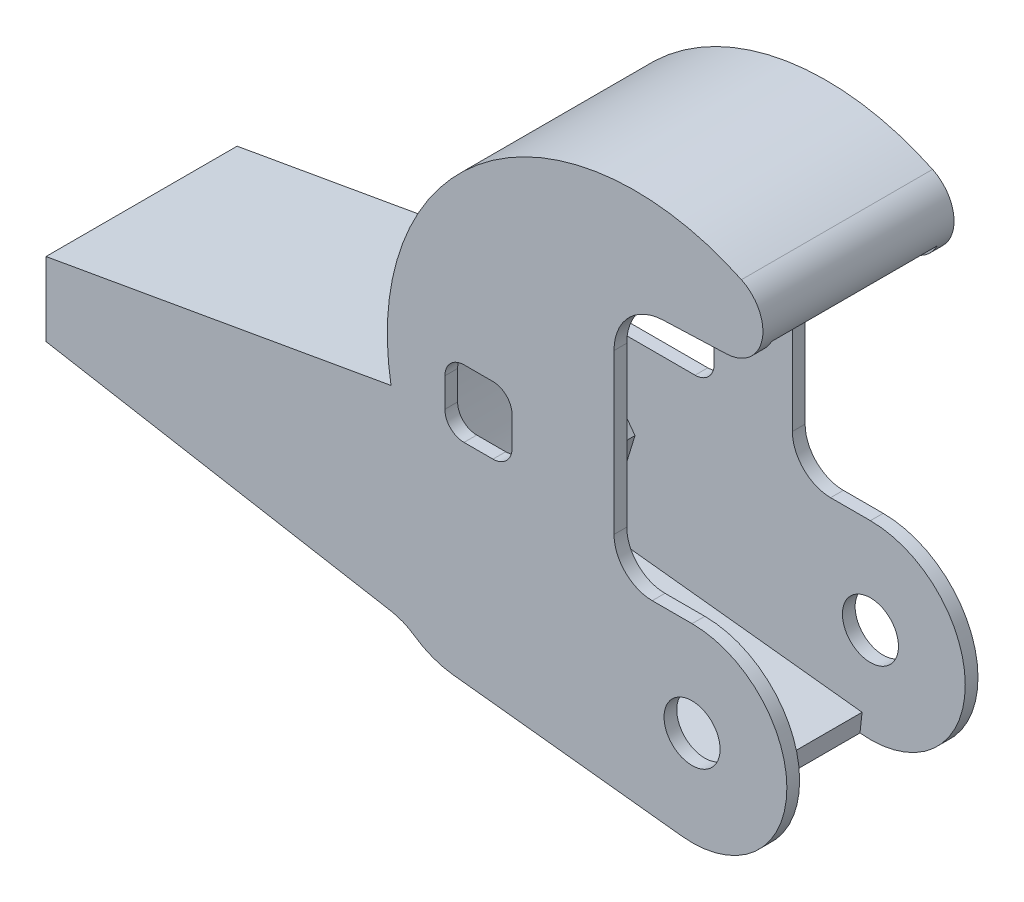
from build123d import *

# Parameters (mm, degrees)
BOSS_EXTRUDE1_DEPTH = 30
SKETCH2_R           = 4.4
CUT_EXTRUDE1_DEPTH  = 101.775803332
SKETCH4_W           = 26
SKETCH4_H           = 53.255509589
CUT_EXTRUDE2_DEPTH  = 40
CUT_EXTRUDE3_DEPTH  = 13
CUT_EXTRUDE4_DEPTH  = 22
CUT_EXTRUDE5_DEPTH  = 29
CUT_EXTRUDE6_DEPTH  = 13
CUT_EXTRUDE7_DEPTH  = 13
CUT_EXTRUDE8_DEPTH  = 13
CUT_EXTRUDE9_DEPTH  = 13


with BuildPart() as part:
    # Sketch1 → Boss-Extrude1 (new body)
    with BuildSketch(Plane.XY):
        with BuildLine():
            Line((-41.88810428, 5.785), (12.276322136, 15.335649772))
            ThreePointArc((12.276322136, 15.335649772), (27.01721186, 53.031344507), (67.276322136, 57.210252411))
            ThreePointArc((67.276322136, 57.210252411), (70.530137672, 50.676906919), (64.962620823, 45.957301533))
            Line((64.962620823, 45.957301533), (54.969956327, 45.574344273))
            ThreePointArc((54.969956327, 45.574344273), (49.512168838, 43.127692894), (47.276322136, 37.580212676))
            Line((47.276322136, 37.580212676), (47.276322136, 12.580212676))
            ThreePointArc((47.276322136, 12.580212676), (49.033681448, 8.337571989), (53.276322136, 6.580212676))
            Line((53.276322136, 6.580212676), (59.526322136, 6.580212676))
            ThreePointArc((59.526322136, 6.580212676), (74.390705288, -9.127420407), (57.887586742, -23.103353356))
            Line((57.887586742, -23.103353356), (22.023718903, -19.131387173))
            ThreePointArc((22.023718903, -19.131387173), (18.826238067, -18.366578697), (15.915778413, -16.837513523))
            ThreePointArc((15.915778413, -16.837513523), (14.177787103, -15.888509343), (12.276322136, -15.335649772))
            Line((12.276322136, -15.335649772), (-41.88810428, -5.785))
            Line((-41.88810428, -5.785), (-41.88810428, 5.785))
        make_face()
    extrude(amount=BOSS_EXTRUDE1_DEPTH)

    # Sketch2 → Cut-Extrude1 (cut, through all)
    with BuildSketch(Plane.XY.offset(30)):
        with Locations((59.526322136, -8.306805028)):
            Circle(SKETCH2_R)
    extrude(amount=-CUT_EXTRUDE1_DEPTH, mode=Mode.SUBTRACT)

    # Sketch4 → Cut-Extrude2 (cut)
    with BuildSketch(Plane(origin=(70, 0, 0), x_dir=(0, 0, -1), z_dir=(1, 0, 0))):
        with Locations((-15, 24.841006249)):
            Rectangle(SKETCH4_W, SKETCH4_H)
    extrude(amount=-CUT_EXTRUDE2_DEPTH, mode=Mode.SUBTRACT)

    # Sketch5 → Cut-Extrude3 (cut, symmetric)
    with BuildSketch(Plane.XY.offset(15)):
        with BuildLine():
            ThreePointArc((30, 51.468761043), (14.752383127, 23.887752406), (27.160195833, -5.082025668))
            add(Edge.make_bspline(
                [(27.160195833, -5.082025668), (28.094948904, -5.887577241), (30.586732107, -8.19455625), (37.238701336, -9.917559519), (48.959505276, -8.540216128), (58.394612416, -6.238640535), (63.488820328, -1.786748546)],
                knots=[0, 0, 0, 0, 0.09340361, 0.26111983, 0.503691176, 1, 1, 1, 1], degree=3))
            Line((63.488820328, -1.786748546), (35, -1.786748546))
            ThreePointArc((35, -1.786748546), (31.464466094, -0.322282452), (30, 3.213251454))
            Line((30, 3.213251454), (30, 51.468761043))
        make_face()
    extrude(amount=CUT_EXTRUDE3_DEPTH, both=True, mode=Mode.SUBTRACT)

    # Sketch6 → Cut-Extrude4 (cut)
    with BuildSketch(Plane.XY.offset(15)):
        with BuildLine():
            Line((32, 24.594919279), (20, 24.594919279))
            ThreePointArc((20, 24.594919279), (17.878679656, 23.716239623), (17, 21.594919279))
            Line((17, 21.594919279), (17, 15.594919279))
            ThreePointArc((17, 15.594919279), (17.878679656, 13.473598935), (20, 12.594919279))
            Line((20, 12.594919279), (32, 12.594919279))
            ThreePointArc((32, 12.594919279), (34.121320344, 13.473598935), (35, 15.594919279))
            Line((35, 15.594919279), (35, 21.594919279))
            ThreePointArc((35, 21.594919279), (34.121320344, 23.716239623), (32, 24.594919279))
        make_face()
    extrude(amount=-CUT_EXTRUDE4_DEPTH, mode=Mode.SUBTRACT)

    # Sketch7 → Cut-Extrude5 (cut)
    with BuildSketch(Plane.XY.offset(15)):
        with BuildLine():
            Line((28.275, 23.869919279), (23.725, 23.869919279))
            ThreePointArc((23.725, 23.869919279), (21.603679656, 22.991239623), (20.725, 20.869919279))
            Line((20.725, 20.869919279), (20.725, 16.319919279))
            ThreePointArc((20.725, 16.319919279), (21.603679656, 14.198598935), (23.725, 13.319919279))
            Line((23.725, 13.319919279), (28.275, 13.319919279))
            ThreePointArc((28.275, 13.319919279), (30.396320344, 14.198598935), (31.275, 16.319919279))
            Line((31.275, 16.319919279), (31.275, 20.869919279))
            ThreePointArc((31.275, 20.869919279), (30.396320344, 22.991239623), (28.275, 23.869919279))
        make_face()
    extrude(amount=CUT_EXTRUDE5_DEPTH, mode=Mode.SUBTRACT)

    # Sketch9 → Cut-Extrude6 (cut, symmetric)
    with BuildSketch(Plane.XY.offset(15)):
        with BuildLine():
            add(Edge.make_bspline(
                [(27.160195833, -5.082025668), (28.094948904, -5.887577241), (30.586732107, -8.19455625), (37.238701336, -9.917559519), (45.927597, -8.896503874), (52.39349387, -7.580878177), (55.560202392, -6.40157691)],
                knots=[0, 0, 0, 0, 0.09340361, 0.26111983, 0.503691176, 0.765483911, 0.765483911, 0.765483911, 0.765483911], degree=3))
            ThreePointArc((55.560202392, -6.40157691), (61.448410701, -12.264781222), (60.481418473, -4.011715857))
            add(Edge.make_bspline(
                [(60.481418473, -4.011715857), (61.522798548, -3.362828802), (62.527928844, -2.626483629), (63.488820328, -1.786748546)],
                knots=[0.906384087, 0.906384087, 0.906384087, 0.906384087, 1, 1, 1, 1], degree=3))
            Line((63.488820328, -1.786748546), (66.958817178, -1.786748546))
            ThreePointArc((66.958817178, -1.786748546), (68.293766616, -12.876819947), (58.4379775, -18.133738682))
            Line((58.4379775, -18.133738682), (22.574109661, -14.161772498))
            ThreePointArc((22.574109661, -14.161772498), (20.584136694, -13.685788976), (18.772793224, -12.734165333))
            Line((18.772793224, -12.734165333), (22.574109661, -0.326656193))
            Line((22.574109661, -0.326656193), (27.160195833, -5.082025668))
        make_face()
    extrude(amount=CUT_EXTRUDE6_DEPTH, both=True, mode=Mode.SUBTRACT)

    # Sketch10 → Cut-Extrude7 (cut, symmetric)
    with BuildSketch(Plane.XY.offset(15)):
        with BuildLine():
            Line((66.958817178, -1.786748546), (70, -1.786748546))
            Line((70, -1.786748546), (70.49467045, -3.724608486))
            ThreePointArc((70.49467045, -3.724608486), (69.041750074, -15.431257361), (58.217821197, -20.121584551))
            Line((58.217821197, -20.121584551), (22.353953358, -16.149618368))
            ThreePointArc((22.353953358, -16.149618368), (19.880977243, -15.558104864), (17.6299873, -14.375504609))
            Line((17.6299873, -14.375504609), (18.772793224, -12.734165333))
            ThreePointArc((18.772793224, -12.734165333), (20.584136694, -13.685788976), (22.574109661, -14.161772498))
            Line((22.574109661, -14.161772498), (58.4379775, -18.133738682))
            ThreePointArc((58.4379775, -18.133738682), (68.293766616, -12.876819947), (66.958817178, -1.786748546))
        make_face()
    extrude(amount=CUT_EXTRUDE7_DEPTH, both=True, mode=Mode.SUBTRACT)

    # Sketch11 → Cut-Extrude8 (cut, symmetric)
    with BuildSketch(Plane.XY.offset(15)):
        with BuildLine():
            Line((58.217821197, -20.121584551), (57.887586742, -23.103353356))
            ThreePointArc((57.887586742, -23.103353356), (72.259948277, -16.01900714), (71.880280462, 0))
            Line((71.880280462, 0), (70, 0))
            Line((70, 0), (70, -1.786748546))
            Line((70, -1.786748546), (70.49467045, -3.724608486))
            ThreePointArc((70.49467045, -3.724608486), (69.041750074, -15.431257361), (58.217821197, -20.121584551))
        make_face()
    extrude(amount=CUT_EXTRUDE8_DEPTH, both=True, mode=Mode.SUBTRACT)

    # Sketch12 → Cut-Extrude9 (cut, symmetric)
    with BuildSketch(Plane.XY.offset(15)):
        with BuildLine():
            Line((70, 0), (70, 2.272673603))
            ThreePointArc((70, 2.272673603), (70.996566459, 1.183020643), (71.880280462, 0))
            Line((71.880280462, 0), (70, 0))
        make_face()
    extrude(amount=CUT_EXTRUDE9_DEPTH, both=True, mode=Mode.SUBTRACT)


solid = part.part
